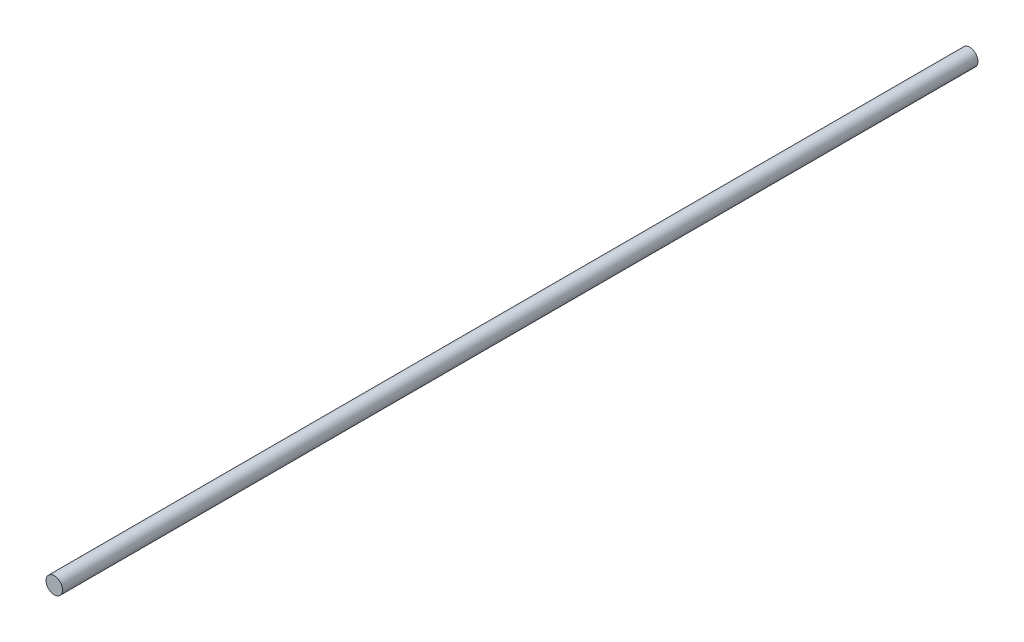
from build123d import *

# Parameters (mm, degrees)
SKETCH1_R           = 7.5
BOSS_EXTRUDE1_DEPTH = 830


with BuildPart() as part:
    # Sketch1 → Boss-Extrude1 (new body)
    with BuildSketch(Plane.XY):
        Circle(SKETCH1_R)
    extrude(amount=BOSS_EXTRUDE1_DEPTH)


solid = part.part
